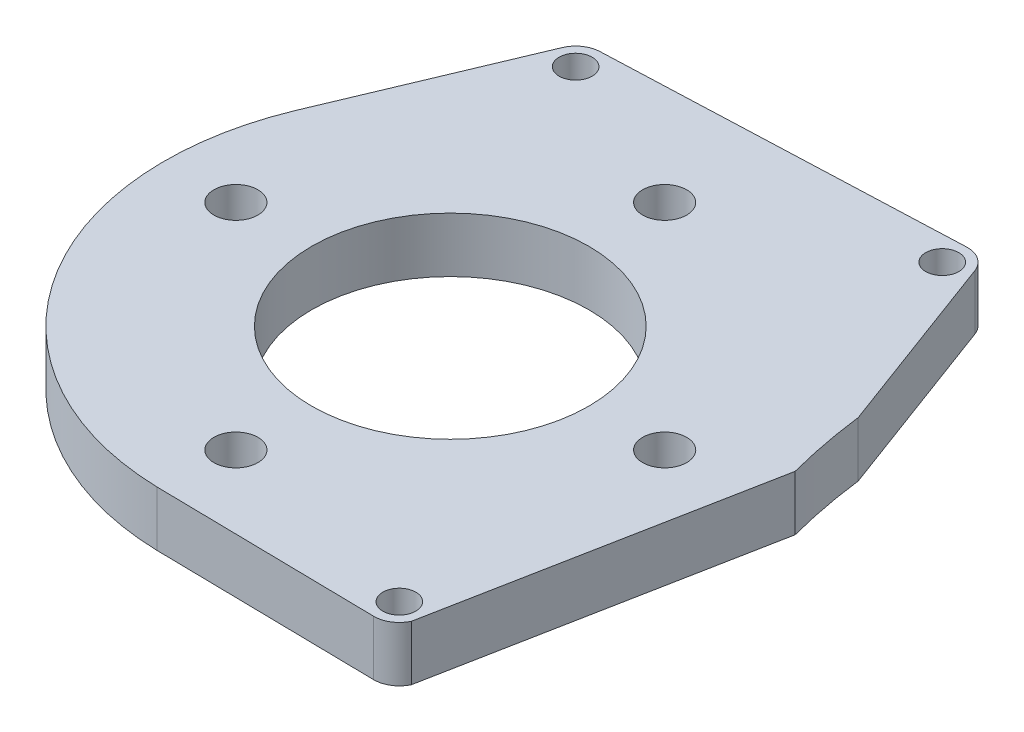
from build123d import *

# Parameters (mm, degrees)
SKETCH1_R           = 2
SKETCH1_R_2         = 12.6
SKETCH1_R_3         = 1.5
BOSS_EXTRUDE1_DEPTH = 5


with BuildPart() as part:
    # Sketch1 → Boss-Extrude1 (new body)
    with BuildSketch(Plane(origin=(0, 0, 0), x_dir=(1, 0, 0), z_dir=(0, 1, 0))):
        with BuildLine():
            Line((-0.695602201, -26.001013021), (19.342742394, -26.333158484))
            ThreePointArc((19.342742394, -26.333158484), (20.605232337, -25.984002388), (21.476990945, -25.006337943))
            Line((21.476990945, -25.006337943), (27.115129107, 4.255894982))
            ThreePointArc((27.115129107, 4.255894982), (26.312930803, 7.784075148), (25.748803556, 11.35805582))
            Line((25.748803556, 11.35805582), (19.484079103, 28.225152951))
            ThreePointArc((19.484079103, 28.225152951), (18.652270353, 29.305251267), (17.355348812, 29.725385394))
            Line((17.355348812, 29.725385394), (-14.839037586, 28.440806231))
            ThreePointArc((-14.839037586, 28.440806231), (-16.054862276, 28.031135004), (-16.861770169, 27.033658807))
            Line((-16.861770169, 27.033658807), (-24.050617364, 9.90476375))
            ThreePointArc((-24.050617364, 9.90476375), (-21.803670495, -14.182259815), (-0.695602201, -26.001013021))
        make_face()
        with Locations(Location((0, 19.5, 0), (0, 0, 270))):
            Circle(SKETCH1_R, mode=Mode.SUBTRACT)
        with Locations(Location((19.5, 0, 0), (0, 0, 270))):
            Circle(SKETCH1_R, mode=Mode.SUBTRACT)
        with Locations(Location((0, -19.5, 0), (0, 0, 270))):
            Circle(SKETCH1_R, mode=Mode.SUBTRACT)
        with Locations(Location((-19.5, 0, 0), (0, 0, 270))):
            Circle(SKETCH1_R, mode=Mode.SUBTRACT)
        with Locations(Location((0, 0, 0), (0, 0, 270))):
            Circle(SKETCH1_R_2, mode=Mode.SUBTRACT)
        with Locations(Location((19.381166369, -24.015039037, 0), (0, 0, 270))):
            Circle(SKETCH1_R_3, mode=Mode.SUBTRACT)
        with Locations(Location((17.326233239, 27.42369259, 0), (0, 0, 270))):
            Circle(SKETCH1_R_3, mode=Mode.SUBTRACT)
        with Locations(Location((-14.742076054, 26.144041757, 0), (0, 0, 270))):
            Circle(SKETCH1_R_3, mode=Mode.SUBTRACT)
    extrude(amount=BOSS_EXTRUDE1_DEPTH)


solid = part.part
